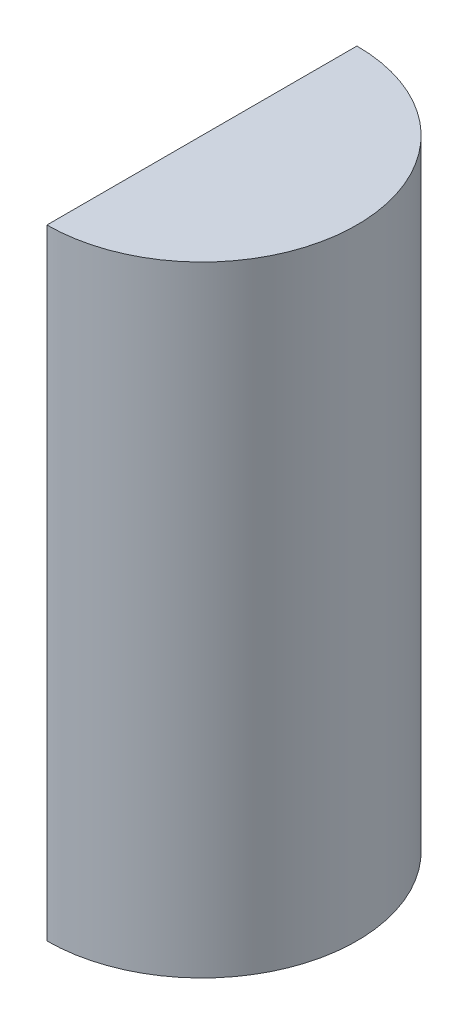
from build123d import *

# Parameters (mm, degrees)
BOSS_EXTRUDE1_DEPTH = 76.2


with BuildPart() as part:
    # Sketch1 → Boss-Extrude1 (new body)
    with BuildSketch(Plane(origin=(0, 0, 0), x_dir=(1, 0, 0), z_dir=(0, 1, 0))):
        with BuildLine():
            Line((0, 19.05), (0, -19.05))
            ThreePointArc((0, -19.05), (19.05, 0), (0, 19.05))
        make_face()
    extrude(amount=BOSS_EXTRUDE1_DEPTH)


solid = part.part
